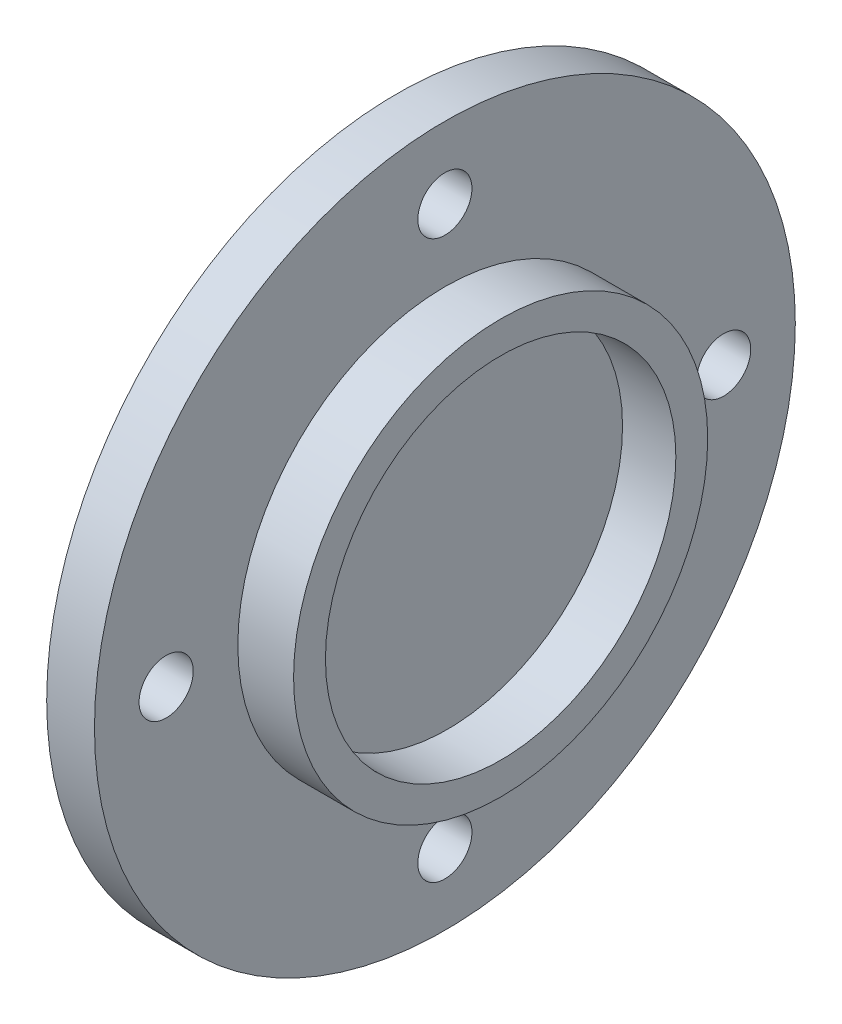
from build123d import *

# Parameters (mm, degrees)
M8_TAPPED_HOLE1_D     = 6.8
M8_TAPPED_HOLE1_DEPTH = 16
M8_TAPPED_HOLE1_TIP   = 2.042926105


with BuildPart() as part:
    # Sketch1 → Revolve1 (revolve)
    with BuildSketch(Plane.XY, mode=Mode.PRIVATE) as revolve1_sk:
        Polygon((-13, 0), (-13, 44), (-7, 44), (-7, 26), (0, 26), (0, 22), (-6.692307692, 22), (-6.692307692, 0), align=None)
    revolve(revolve1_sk.sketch.rotate(Axis((-37.153846154, 0, 0), (1, 0, 0)), 90), axis=Axis((-37.153846154, 0, 0), (1, 0, 0)))

    # M8 Tapped Hole1
    with Locations(Plane(origin=(-13, 0, -35), x_dir=(0, 0, -1), z_dir=(-1, 0, 0))):
        with Locations((0, 0), (-35, 35), (-70, 0), (-35, -35)):
            Hole(M8_TAPPED_HOLE1_D / 2, depth=M8_TAPPED_HOLE1_DEPTH)
            with Locations((0, 0, -(M8_TAPPED_HOLE1_DEPTH + M8_TAPPED_HOLE1_TIP / 2))):  # 118° drill point
                Cone(0, M8_TAPPED_HOLE1_D / 2, M8_TAPPED_HOLE1_TIP, mode=Mode.SUBTRACT)


solid = part.part
